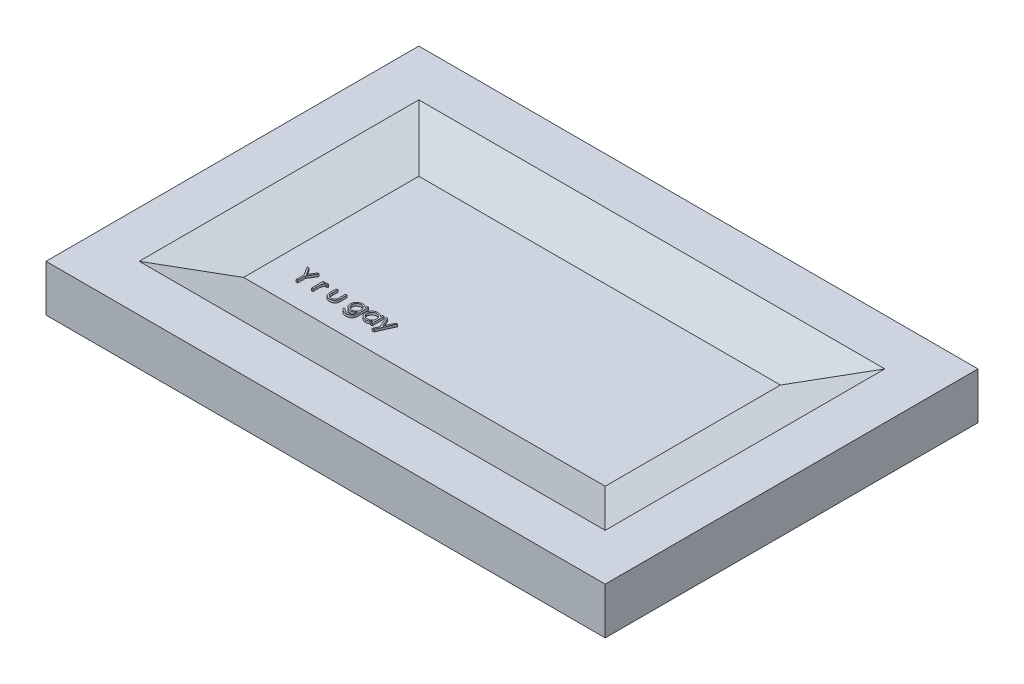
from build123d import *

# Parameters (mm, degrees)
SKETCH1_W           = 120
SKETCH1_H           = 80
BOSS_EXTRUDE1_DEPTH = 5
CUT_EXTRUDE1_DEPTH  = 3
CUT_EXTRUDE1_TAPER  = 75
SKETCH2_W           = 100
SKETCH2_H           = 60
CUT_EXTRUDE2_DEPTH  = 3
CUT_EXTRUDE2_DRAFT  = -75
BOSS_EXTRUDE2_DEPTH = 0.5


with BuildPart() as part:
    # Sketch1 → Boss-Extrude1 (new, symmetric)
    with BuildSketch(Plane(origin=(0, 0, 0), x_dir=(1, 0, 0), z_dir=(0, 1, 0))):
        Rectangle(SKETCH1_W, SKETCH1_H)
    extrude(amount=BOSS_EXTRUDE1_DEPTH, both=True)

    # 3DSketch1 → Cut-Extrude1 (cut)
    with BuildSketch(Plane(origin=(-50, 5, 30), x_dir=(0.8574929257125442, 0, -0.5144957554275267), z_dir=(0, -1, 0))):
        Polygon((0, 0), (30.869745326, -51.449575543), (116.619037897, 0), (85.749292571, 51.449575543), align=None)
    extrude(amount=CUT_EXTRUDE1_DEPTH, taper=CUT_EXTRUDE1_TAPER, mode=Mode.SUBTRACT)


with BuildPart() as cut_extrude2_tool:
    # Sketch2 → Cut-Extrude2 (with draft: the straight prism first)
    with BuildSketch(Plane.XZ.offset(5)):
        Rectangle(SKETCH2_W, SKETCH2_H)
    extrude(amount=-CUT_EXTRUDE2_DEPTH)
    # Cut-Extrude2: the draft: its side faces are tilted about the plane it starts from
    cut_extrude2_sides = [cut_extrude2_tool.faces().sort_by_distance(p)[0] for p in [
        (-50, -3.5, 0),
        (0, -3.5, -30),
        (50, -3.5, 0),
        (0, -3.5, 30),
    ]]
    draft(cut_extrude2_sides, Plane.XZ.offset(5), CUT_EXTRUDE2_DRAFT)


with BuildPart() as part_1:
    add(part.part)

    # Cut-Extrude2: cut by cut_extrude2_tool
    add(cut_extrude2_tool.part, mode=Mode.SUBTRACT)

    # Sketch3 → Boss-Extrude2 (add)
    # profile 1 of 6: a face of its own
    with BuildSketch(Plane(origin=(0, 2, 0), x_dir=(1, 0, 0), z_dir=(0, 1, 0))):
        Polygon((-33.400512967, -10.522417644), (-33.040837487, -10.522417644), (-32.120965692, -12.026323894), (-31.202496141, -10.522417644), (-30.84282066, -10.522417644), (-31.964615532, -12.358655625), (-31.964615532, -14.022417644), (-32.278718096, -14.022417644), (-32.278718096, -12.358655625), align=None)
    # profile 2 of 6: a face of its own
    with BuildSketch(Plane(origin=(0, 2, 0), x_dir=(1, 0, 0), z_dir=(0, 1, 0))):
        with BuildLine():
            Line((-29.047948865, -11.464725336), (-28.733846301, -11.464725336))
            Line((-28.733846301, -11.464725336), (-28.733846301, -11.84122774))
            add(Edge.make_bspline(
                [(-28.733846301, -11.84122774), (-28.710657542, -11.806171912), (-28.666309221, -11.739127912), (-28.592596292, -11.650458611), (-28.51709296, -11.577043565), (-28.439437773, -11.518540046), (-28.359059673, -11.474726927), (-28.277722722, -11.442633892), (-28.194147252, -11.423656577), (-28.137985327, -11.421122918), (-28.109847903, -11.419853541)],
                knots=[0, 0, 0, 0, 1.2804753, 2.448899062, 3.506932113, 4.484331642, 5.4025378, 6.288909075, 7.142734305, 8, 8, 8, 8], degree=3))
            add(Edge.make_bspline(
                [(-28.109847903, -11.419853541), (-28.088021577, -11.421044068), (-28.043112492, -11.423493654), (-27.975129902, -11.440704478), (-27.90508645, -11.468182501), (-27.859944063, -11.494022724), (-27.836410403, -11.507493766)],
                knots=[0, 0, 0, 0, 0.901110191, 1.854092781, 2.881294221, 4, 4, 4, 4], degree=3))
            Line((-27.836410403, -11.507493766), (-28.008886365, -11.779529022))
            add(Edge.make_bspline(
                [(-28.008886365, -11.779529022), (-28.023995386, -11.772788756), (-28.052675201, -11.75999444), (-28.094629767, -11.74485243), (-28.133311104, -11.735936514), (-28.157954662, -11.734585797), (-28.169443256, -11.733956105)],
                knots=[0, 0, 0, 0, 1.180555205, 2.24091978, 3.179933427, 4, 4, 4, 4], degree=3))
            add(Edge.make_bspline(
                [(-28.169443256, -11.733956105), (-28.194648989, -11.735636143), (-28.246061379, -11.739062932), (-28.321545879, -11.76600174), (-28.394793084, -11.80952698), (-28.452964747, -11.857798092), (-28.498007, -11.904345889), (-28.530147225, -11.944994292), (-28.559629972, -11.990572923), (-28.587800192, -12.040302607), (-28.613466487, -12.095032453), (-28.637421156, -12.154215666), (-28.659080019, -12.217920795), (-28.671430263, -12.262303315), (-28.677756557, -12.285037836)],
                knots=[0, 0, 0, 0, 1.125678352, 2.296057538, 3.5422874, 4.923748041, 5.663163013, 6.437101912, 7.23742474, 8.08941207, 8.991984279, 9.93940061, 10.944477711, 12, 12, 12, 12], degree=3))
            add(Edge.make_bspline(
                [(-28.677756557, -12.285037836), (-28.682488951, -12.30531501), (-28.692970842, -12.350227408), (-28.70316238, -12.425575933), (-28.713231898, -12.514599592), (-28.720328516, -12.617546185), (-28.726906559, -12.734158629), (-28.730616641, -12.864614574), (-28.733719781, -13.009047925), (-28.733802848, -13.110022279), (-28.733846301, -13.162842323)],
                knots=[0, 0, 0, 0, 0.566838948, 1.255505196, 2.06880316, 3.007127437, 4.065329342, 5.249902469, 6.561414163, 8, 8, 8, 8], degree=3))
            Line((-28.733846301, -13.162842323), (-28.733846301, -14.022417644))
            Line((-28.733846301, -14.022417644), (-29.047948865, -14.022417644))
            Line((-29.047948865, -14.022417644), (-29.047948865, -11.464725336))
        make_face()
    # profile 3 of 6: a face of its own
    with BuildSketch(Plane(origin=(0, 2, 0), x_dir=(1, 0, 0), z_dir=(0, 1, 0))):
        with BuildLine():
            Line((-26.221025788, -11.464725336), (-25.906923224, -11.464725336))
            Line((-25.906923224, -11.464725336), (-25.906923224, -12.651023413))
            add(Edge.make_bspline(
                [(-25.906923224, -12.651023413), (-25.906781319, -12.685846162), (-25.906509862, -12.75246045), (-25.904668921, -12.848315637), (-25.900338827, -12.93573235), (-25.894925002, -13.014761086), (-25.887962866, -13.085388478), (-25.879679506, -13.147367835), (-25.870421084, -13.201402019), (-25.86135837, -13.233945375), (-25.857143576, -13.249080304)],
                knots=[0, 0, 0, 0, 1.388932606, 2.656963016, 3.823490214, 4.879454478, 5.816252168, 6.653371382, 7.373723809, 8, 8, 8, 8], degree=3))
            add(Edge.make_bspline(
                [(-25.857143576, -13.249080304), (-25.850382121, -13.268103175), (-25.83699978, -13.305753436), (-25.812726297, -13.360142441), (-25.78269796, -13.410517724), (-25.749838132, -13.458821796), (-25.711938725, -13.503623783), (-25.669479253, -13.544848027), (-25.623881016, -13.584052118), (-25.556125993, -13.63043691), (-25.463466727, -13.68015224), (-25.341813972, -13.723048059), (-25.209909746, -13.748683879), (-25.118745027, -13.751658134), (-25.071887166, -13.753186875)],
                knots=[0, 0, 0, 0, 0.725840625, 1.436591201, 2.137033971, 2.831655856, 3.53531722, 4.242432219, 4.957935707, 5.694543706, 7.190802206, 8.724350549, 10.316345118, 12, 12, 12, 12], degree=3))
            add(Edge.make_bspline(
                [(-25.071887166, -13.753186875), (-25.025033658, -13.751625626), (-24.93438079, -13.748604899), (-24.803925821, -13.72382136), (-24.684674406, -13.682415671), (-24.577823455, -13.624608259), (-24.483857615, -13.553866197), (-24.405553196, -13.470857388), (-24.340945942, -13.378208001), (-24.312736521, -13.309083722), (-24.298549826, -13.274320689)],
                knots=[0, 0, 0, 0, 1.157059328, 2.238695713, 3.266970494, 4.264342957, 5.228770407, 6.160125903, 7.074715775, 8, 8, 8, 8], degree=3))
            add(Edge.make_bspline(
                [(-24.298549826, -13.274320689), (-24.294355596, -13.26035439), (-24.285083178, -13.229478315), (-24.275120827, -13.177098566), (-24.266146365, -13.114633962), (-24.258483189, -13.041675753), (-24.253018026, -12.958414601), (-24.250072, -12.864876524), (-24.246743724, -12.761355164), (-24.246693208, -12.688887405), (-24.246666814, -12.651023413)],
                knots=[0, 0, 0, 0, 0.557542046, 1.232589297, 2.036731608, 2.971723315, 4.038036528, 5.22795436, 6.551621927, 8, 8, 8, 8], degree=3))
            Line((-24.246666814, -12.651023413), (-24.246666814, -11.464725336))
            Line((-24.246666814, -11.464725336), (-23.93256425, -11.464725336))
            Line((-23.93256425, -11.464725336), (-23.93256425, -12.709917644))
            add(Edge.make_bspline(
                [(-23.93256425, -12.709917644), (-23.933005944, -12.752224815), (-23.933862893, -12.834306515), (-23.939370236, -12.953590627), (-23.948819849, -13.064752872), (-23.963162534, -13.167852091), (-23.980028208, -13.262809573), (-24.001784481, -13.349747019), (-24.027762719, -13.428396573), (-24.057068234, -13.50013835), (-24.091690102, -13.565185244), (-24.128517122, -13.626921061), (-24.171041894, -13.683813996), (-24.215812128, -13.738696133), (-24.265613784, -13.788837661), (-24.319513643, -13.835389136), (-24.376753063, -13.879062168), (-24.438602261, -13.918153448), (-24.504158324, -13.953370093), (-24.573502181, -13.984586171), (-24.647483179, -14.009288748), (-24.725146816, -14.030599414), (-24.806873595, -14.047313883), (-24.892584728, -14.05910045), (-24.982251345, -14.066325781), (-25.043360804, -14.066962825), (-25.074691653, -14.067289439)],
                knots=[0, 0, 0, 0, 1.493040784, 2.896703357, 4.213163133, 5.428574705, 6.569057535, 7.615249723, 8.588095153, 9.490268104, 10.346124644, 11.18633936, 12.024365274, 12.850166724, 13.684164916, 14.514361689, 15.362232829, 16.222528818, 17.093394965, 17.986930858, 18.902426812, 19.842810585, 20.827885679, 21.843828298, 22.894529745, 24, 24, 24, 24], degree=3))
            add(Edge.make_bspline(
                [(-25.074691653, -14.067289439), (-25.105788167, -14.066949732), (-25.166895713, -14.066282175), (-25.256566957, -14.059140368), (-25.342515563, -14.047332197), (-25.424435962, -14.03047698), (-25.502410359, -14.00943791), (-25.576754599, -13.984434374), (-25.646598162, -13.953353892), (-25.712780166, -13.918376335), (-25.774782554, -13.87881106), (-25.832891132, -13.83544302), (-25.887027985, -13.788336957), (-25.937205053, -13.7376896), (-25.982718029, -13.682872663), (-26.024134071, -13.624327103), (-26.062090776, -13.562633014), (-26.096443566, -13.496569852), (-26.125955322, -13.423997842), (-26.152010568, -13.343700745), (-26.173321206, -13.254798228), (-26.190663675, -13.1573663), (-26.204615115, -13.051871258), (-26.214301257, -12.937702843), (-26.219717088, -12.815139151), (-26.22058015, -12.730489261), (-26.221025788, -12.686780625)],
                knots=[0, 0, 0, 0, 1.083640291, 2.129454052, 3.13281866, 4.105697902, 5.042300162, 5.946461698, 6.836384745, 7.703652036, 8.553297018, 9.397182691, 10.228592656, 11.052265423, 11.879314572, 12.708807002, 13.549817954, 14.402308542, 15.300838682, 16.27712199, 17.341985831, 18.484375296, 19.725102775, 21.0496083, 22.476576903, 24, 24, 24, 24], degree=3))
            Line((-26.221025788, -12.686780625), (-26.221025788, -11.464725336))
        make_face()
    # profile 4 of 6: a face of its own
    with BuildSketch(Plane(origin=(0, 2, 0), x_dir=(1, 0, 0), z_dir=(0, 1, 0))):
        with BuildLine():
            Line((-19.624871942, -11.464725336), (-19.310769378, -11.464725336))
            Line((-19.310769378, -11.464725336), (-19.310769378, -13.494472932))
            add(Edge.make_bspline(
                [(-19.310769378, -13.494472932), (-19.31104642, -13.537710527), (-19.311581179, -13.6211695), (-19.31543215, -13.741847779), (-19.323552828, -13.853313865), (-19.332761509, -13.956076123), (-19.346008225, -14.049658233), (-19.362184593, -14.134339438), (-19.380420272, -14.210201), (-19.396440489, -14.256925841), (-19.404018576, -14.279028221)],
                knots=[0, 0, 0, 0, 1.307562039, 2.523909702, 3.650326591, 4.686913197, 5.643429486, 6.506965704, 7.293745905, 8, 8, 8, 8], degree=3))
            add(Edge.make_bspline(
                [(-19.404018576, -14.279028221), (-19.415207815, -14.307758142), (-19.437251742, -14.364358979), (-19.478537375, -14.4445933), (-19.524771279, -14.52013969), (-19.577578029, -14.590577141), (-19.636718833, -14.655552054), (-19.700800326, -14.716476053), (-19.771070517, -14.77206022), (-19.847489229, -14.821345518), (-19.928294862, -14.865732572), (-20.013440964, -14.904179139), (-20.102447403, -14.937665983), (-20.196150294, -14.962748778), (-20.293080529, -14.984483499), (-20.39437796, -14.998628185), (-20.499450757, -15.008255243), (-20.570896137, -15.009145476), (-20.607143576, -15.009597131)],
                knots=[0, 0, 0, 0, 0.981931301, 1.934503488, 2.87077864, 3.801706999, 4.735015492, 5.667491629, 6.616593066, 7.585388521, 8.561939025, 9.551802639, 10.560317337, 11.588439944, 12.640189604, 13.723962949, 14.845264515, 16, 16, 16, 16], degree=3))
            add(Edge.make_bspline(
                [(-20.607143576, -15.009597131), (-20.660028311, -15.008740645), (-20.763326406, -15.007067698), (-20.913931399, -14.987576783), (-21.056966119, -14.96002241), (-21.190540576, -14.918316982), (-21.313810672, -14.867279993), (-21.425934548, -14.80868504), (-21.525905656, -14.741495731), (-21.616029329, -14.66499513), (-21.697370919, -14.574031448), (-21.773898209, -14.466832604), (-21.84755915, -14.341765715), (-21.890727788, -14.249973002), (-21.91333348, -14.201904823)],
                knots=[0, 0, 0, 0, 1.157897085, 2.2616841, 3.32207898, 4.345638746, 5.321241055, 6.241986252, 7.112515963, 7.955008012, 8.825025602, 9.77857164, 10.836726669, 12, 12, 12, 12], degree=3))
            Line((-21.91333348, -14.201904823), (-21.599230916, -14.201904823))
            add(Edge.make_bspline(
                [(-21.599230916, -14.201904823), (-21.573968707, -14.242010699), (-21.524584198, -14.320412748), (-21.432235718, -14.421925903), (-21.331029391, -14.508679268), (-21.217549708, -14.578590042), (-21.091324493, -14.631299834), (-20.952277806, -14.66887513), (-20.799278185, -14.691371397), (-20.69275997, -14.694082691), (-20.637291814, -14.695494567)],
                knots=[0, 0, 0, 0, 0.997731894, 1.950442991, 2.880492273, 3.800895997, 4.748200782, 5.754801363, 6.83083817, 8, 8, 8, 8], degree=3))
            add(Edge.make_bspline(
                [(-20.637291814, -14.695494567), (-20.582524923, -14.694064418), (-20.476939841, -14.691307234), (-20.325108672, -14.66886509), (-20.186513734, -14.631291656), (-20.061953533, -14.57868327), (-19.952897764, -14.514232864), (-19.858885773, -14.442232789), (-19.782741097, -14.361051786), (-19.73152813, -14.28626998), (-19.699693513, -14.21964585), (-19.679421276, -14.162293254), (-19.662947306, -14.097440377), (-19.649167469, -14.025304641), (-19.637796556, -13.945782984), (-19.630593673, -13.85869358), (-19.625387862, -13.764234358), (-19.625047892, -13.69874122), (-19.624871942, -13.664845528)],
                knots=[0, 0, 0, 0, 1.570740765, 3.028230971, 4.391408896, 5.680370741, 6.894727393, 8.017376726, 9.065722033, 10.075533815, 10.603371122, 11.180248986, 11.817768598, 12.521299649, 13.286540596, 14.121245857, 15.027658897, 16, 16, 16, 16], degree=3))
            Line((-19.624871942, -13.664845528), (-19.624871942, -13.532333509))
            add(Edge.make_bspline(
                [(-19.624871942, -13.532333509), (-19.656753059, -13.570275311), (-19.719954515, -13.645491531), (-19.829101842, -13.744053168), (-19.948318758, -13.828939298), (-20.0774023, -13.898557932), (-20.213190542, -13.954239357), (-20.354212773, -13.993182318), (-20.499204828, -14.018342218), (-20.597456978, -14.021049534), (-20.647107519, -14.022417644)],
                knots=[0, 0, 0, 0, 1.012485704, 2.007162095, 2.997754123, 3.998611389, 4.999708251, 5.992315798, 6.98544096, 8, 8, 8, 8], degree=3))
            add(Edge.make_bspline(
                [(-20.647107519, -14.022417644), (-20.676343788, -14.021902617), (-20.734470346, -14.020878659), (-20.820825093, -14.011919882), (-20.905905531, -13.998921139), (-20.989513235, -13.9798397), (-21.071768848, -13.955347974), (-21.15253644, -13.924731235), (-21.232469967, -13.890116117), (-21.310116465, -13.849343313), (-21.384702595, -13.803981007), (-21.45566578, -13.754842116), (-21.52263432, -13.702183828), (-21.584970809, -13.645486888), (-21.64259348, -13.584833355), (-21.696277348, -13.520869802), (-21.745134696, -13.452703061), (-21.790168085, -13.381576103), (-21.829225635, -13.307015179), (-21.863510007, -13.230637084), (-21.893319412, -13.152605129), (-21.917084814, -13.072658067), (-21.935235927, -12.990846298), (-21.948746154, -12.907303849), (-21.956409086, -12.821773461), (-21.95760401, -12.764152112), (-21.958205275, -12.735158028)],
                knots=[0, 0, 0, 0, 1.028754217, 2.045334182, 3.052854819, 4.056607503, 5.061168794, 6.071104265, 7.095078842, 8.125279047, 9.155117945, 10.165957491, 11.161587969, 12.151493252, 13.128948131, 14.104219989, 15.088194871, 16.07871515, 17.064853787, 18.047899887, 19.02414258, 20.002704429, 20.980574569, 21.971845993, 22.979467364, 24, 24, 24, 24], degree=3))
            add(Edge.make_bspline(
                [(-21.958205275, -12.735158028), (-21.957686109, -12.706154932), (-21.956649787, -12.648261074), (-21.947698808, -12.562381688), (-21.934930618, -12.477652253), (-21.914722849, -12.394946111), (-21.890400327, -12.31332136), (-21.860276754, -12.233380903), (-21.824057995, -12.155100394), (-21.783048245, -12.078421863), (-21.736964153, -12.004374248), (-21.686431672, -11.934047602), (-21.631389798, -11.86795943), (-21.572597882, -11.805443008), (-21.509338065, -11.747101515), (-21.441643073, -11.69307655), (-21.370180192, -11.642462524), (-21.294727942, -11.596351186), (-21.216450554, -11.55556894), (-21.137336736, -11.518356343), (-21.056338501, -11.488822223), (-20.974965962, -11.462799124), (-20.891786047, -11.444363929), (-20.807818653, -11.430141687), (-20.722776315, -11.421476966), (-20.66582342, -11.420395381), (-20.637291814, -11.419853541)],
                knots=[0, 0, 0, 0, 1.008818848, 2.013730394, 3.001654427, 3.987803273, 4.973046549, 5.963777569, 6.957074694, 7.972068341, 8.987420212, 9.989399531, 10.982630087, 11.977756091, 12.973280677, 13.973972381, 14.989194003, 16.018387222, 17.047741039, 18.059210846, 19.057554164, 20.045176975, 21.029480261, 22.018708529, 23.007435371, 24, 24, 24, 24], degree=3))
            add(Edge.make_bspline(
                [(-20.637291814, -11.419853541), (-20.590240875, -11.421210215), (-20.497329727, -11.423889227), (-20.360598725, -11.444910373), (-20.228656485, -11.478424386), (-20.100758469, -11.526440017), (-19.975862818, -11.591990055), (-19.854381163, -11.678333003), (-19.735962029, -11.786243343), (-19.662884198, -11.868996207), (-19.624871942, -11.912041041)],
                knots=[0, 0, 0, 0, 0.96728863, 1.910097829, 2.838038873, 3.762875196, 4.71315279, 5.730631239, 6.819562287, 8, 8, 8, 8], degree=3))
            Line((-19.624871942, -11.912041041), (-19.624871942, -11.464725336))
        make_face()
        with BuildLine():
            add(Edge.make_bspline(
                [(-20.612051429, -11.733956105), (-20.657982133, -11.735517171), (-20.748915187, -11.73860775), (-20.88220353, -11.764992463), (-21.010880463, -11.806338363), (-21.132485891, -11.865480978), (-21.246393001, -11.937575216), (-21.347467822, -12.024915504), (-21.435872738, -12.124661701), (-21.510655676, -12.235911948), (-21.570187043, -12.355934223), (-21.612330462, -12.482444957), (-21.639580485, -12.61339995), (-21.642588137, -12.702772553), (-21.644102711, -12.747778221)],
                knots=[0, 0, 0, 0, 1.026226791, 2.031711442, 3.026614839, 4.04107745, 5.047145931, 6.032893242, 7.017642609, 8.019221815, 9.021877557, 10.003543541, 10.994637589, 12, 12, 12, 12], degree=3))
            add(Edge.make_bspline(
                [(-21.644102711, -12.747778221), (-21.643376954, -12.781711493), (-21.641949603, -12.848448317), (-21.628226025, -12.946386212), (-21.60604506, -13.039666526), (-21.574607854, -13.1282949), (-21.535655159, -13.212779695), (-21.486662788, -13.29253893), (-21.429011816, -13.367643636), (-21.363153478, -13.437538318), (-21.290577096, -13.501199286), (-21.211857897, -13.557137327), (-21.127102647, -13.602888048), (-21.038395837, -13.642428885), (-20.943585081, -13.671307953), (-20.844035995, -13.693346732), (-20.739044298, -13.70595549), (-20.667472559, -13.707518287), (-20.630981717, -13.70831508)],
                knots=[0, 0, 0, 0, 1.039728707, 2.044842319, 3.024901384, 3.974314358, 4.923051295, 5.871625912, 6.837440708, 7.820715446, 8.810779094, 9.792721783, 10.773906224, 11.758876063, 12.764959493, 13.806266761, 14.881525401, 16, 16, 16, 16], degree=3))
            add(Edge.make_bspline(
                [(-20.630981717, -13.70831508), (-20.594017959, -13.707547471), (-20.521735722, -13.706046419), (-20.416164785, -13.693142921), (-20.316132045, -13.672320944), (-20.221729223, -13.642757919), (-20.132599882, -13.605036169), (-20.049745267, -13.557299551), (-19.971388819, -13.502935119), (-19.900032409, -13.439523105), (-19.835508244, -13.36963811), (-19.779277477, -13.293593215), (-19.731363028, -13.212532696), (-19.691685358, -13.12646569), (-19.661394154, -13.034723337), (-19.641075249, -12.937534981), (-19.626868504, -12.835366242), (-19.625547579, -12.765357626), (-19.624871942, -12.729549054)],
                knots=[0, 0, 0, 0, 1.121943988, 2.193949579, 3.223793937, 4.220241907, 5.192961521, 6.155822191, 7.11847367, 8.083710714, 9.04790392, 10.001595906, 10.949595423, 11.902125208, 12.873731292, 13.87582262, 14.913508608, 16, 16, 16, 16], degree=3))
            add(Edge.make_bspline(
                [(-19.624871942, -12.729549054), (-19.62621151, -12.6829312), (-19.628828555, -12.591856295), (-19.653525713, -12.459149527), (-19.693345923, -12.334380853), (-19.749192676, -12.217944877), (-19.819174684, -12.111075328), (-19.903465533, -12.015751483), (-20.000611564, -11.931850627), (-20.110333664, -11.861952433), (-20.228381109, -11.805486999), (-20.351902305, -11.763125227), (-20.480713869, -11.739130912), (-20.568020279, -11.735690968), (-20.612051429, -11.733956105)],
                knots=[0, 0, 0, 0, 1.070913519, 2.092188694, 3.091357305, 4.074328408, 5.051968682, 6.018948707, 6.99050112, 7.9935919, 9.000589572, 9.992915277, 10.987769056, 12, 12, 12, 12], degree=3))
        make_face(mode=Mode.SUBTRACT)
    # profile 5 of 6: a face of its own
    with BuildSketch(Plane(origin=(0, 2, 0), x_dir=(1, 0, 0), z_dir=(0, 1, 0))):
        with BuildLine():
            Line((-15.990256557, -11.464725336), (-15.990256557, -14.022417644))
            Line((-15.990256557, -14.022417644), (-16.304359121, -14.022417644))
            Line((-16.304359121, -14.022417644), (-16.304359121, -13.580009791))
            add(Edge.make_bspline(
                [(-16.304359121, -13.580009791), (-16.339777912, -13.620049385), (-16.408898127, -13.698187156), (-16.524339245, -13.800269329), (-16.646707423, -13.88464765), (-16.775408744, -13.952797566), (-16.910326988, -14.003989622), (-17.051163075, -14.040375781), (-17.197974456, -14.063769617), (-17.298226811, -14.066105639), (-17.349030596, -14.067289439)],
                knots=[0, 0, 0, 0, 1.074387032, 2.096679803, 3.090159297, 4.057316773, 5.018401886, 5.985159533, 6.978961417, 8, 8, 8, 8], degree=3))
            add(Edge.make_bspline(
                [(-17.349030596, -14.067289439), (-17.39419855, -14.066063066), (-17.483271754, -14.063644606), (-17.614300832, -14.044882302), (-17.740393081, -14.014751681), (-17.861667654, -13.972850791), (-17.977339799, -13.91726997), (-18.088399896, -13.850728722), (-18.194272588, -13.771487891), (-18.293344127, -13.680899863), (-18.384576127, -13.582504876), (-18.4646374, -13.477559329), (-18.53139048, -13.366517025), (-18.58721056, -13.250783871), (-18.630206905, -13.129468952), (-18.660180539, -13.002991784), (-18.678920986, -12.87150191), (-18.681338446, -12.781962387), (-18.68256425, -12.736560272)],
                knots=[0, 0, 0, 0, 1.033919861, 2.038935746, 3.024066025, 3.998881131, 4.97069526, 5.957263378, 6.95902576, 7.993208707, 9.027059324, 10.027763471, 11.009749337, 11.988697705, 12.965288445, 13.950418724, 14.960734635, 16, 16, 16, 16], degree=3))
            add(Edge.make_bspline(
                [(-18.68256425, -12.736560272), (-18.681311278, -12.692096568), (-18.678834221, -12.604194225), (-18.660381001, -12.474915527), (-18.629349993, -12.350397266), (-18.585802145, -12.231040323), (-18.52996019, -12.116700273), (-18.462032103, -12.007296248), (-18.382012978, -11.902526851), (-18.289760571, -11.804855624), (-18.189825801, -11.714635009), (-18.08291707, -11.636225964), (-17.971693789, -11.568509115), (-17.854430779, -11.514855639), (-17.732863674, -11.471446534), (-17.605910228, -11.441413566), (-17.474098649, -11.423716245), (-17.384608157, -11.421153481), (-17.339214891, -11.419853541)],
                knots=[0, 0, 0, 0, 1.020392517, 2.01726096, 2.990465484, 3.961182959, 4.928053699, 5.906110375, 6.912531644, 7.948652711, 8.985773172, 9.998621852, 10.987621588, 11.969261332, 12.953316658, 13.946091881, 14.958173133, 16, 16, 16, 16], degree=3))
            add(Edge.make_bspline(
                [(-17.339214891, -11.419853541), (-17.287015031, -11.421291293), (-17.184653572, -11.424110656), (-17.034925562, -11.447573383), (-16.893281084, -11.48721185), (-16.758626732, -11.541129348), (-16.631446046, -11.612778077), (-16.512943062, -11.703158038), (-16.401877579, -11.811699225), (-16.337497287, -11.89506967), (-16.304359121, -11.937982548)],
                knots=[0, 0, 0, 0, 1.038897134, 2.037228247, 3.008116434, 3.962042015, 4.918381754, 5.904844433, 6.921570401, 8, 8, 8, 8], degree=3))
            Line((-16.304359121, -11.937982548), (-16.304359121, -11.464725336))
            Line((-16.304359121, -11.464725336), (-15.990256557, -11.464725336))
        make_face()
        with BuildLine():
            add(Edge.make_bspline(
                [(-17.33500816, -11.733956105), (-17.380922498, -11.735589743), (-17.471550098, -11.738814284), (-17.6045941, -11.763987779), (-17.731907514, -11.805872374), (-17.852853588, -11.863154275), (-17.965521805, -11.935183011), (-18.066215476, -12.022304395), (-18.155758177, -12.122141409), (-18.231066441, -12.234243519), (-18.292456938, -12.35442161), (-18.33562397, -12.480046048), (-18.364093217, -12.608851026), (-18.367001738, -12.696213712), (-18.368461685, -12.740065881)],
                knots=[0, 0, 0, 0, 1.031046209, 2.035121221, 3.029706178, 4.034933723, 5.034054252, 6.02443088, 7.017295772, 8.038157696, 9.050218397, 10.03989886, 11.016116709, 12, 12, 12, 12], degree=3))
            add(Edge.make_bspline(
                [(-18.368461685, -12.740065881), (-18.366596792, -12.783655988), (-18.362874315, -12.870665344), (-18.336123621, -12.999645921), (-18.291243747, -13.125299963), (-18.230001685, -13.246560956), (-18.15331506, -13.359145057), (-18.064426407, -13.460885179), (-17.962476126, -13.548374768), (-17.849548619, -13.621612341), (-17.728940649, -13.680774862), (-17.602106717, -13.721940502), (-17.471431079, -13.748518282), (-17.382578745, -13.751622759), (-17.337812647, -13.753186875)],
                knots=[0, 0, 0, 0, 0.979072187, 1.954306742, 2.945804271, 3.96968567, 4.997920485, 5.998718438, 6.996577872, 8.005894225, 9.015743152, 10.005417472, 10.995077863, 12, 12, 12, 12], degree=3))
            add(Edge.make_bspline(
                [(-17.337812647, -13.753186875), (-17.292366144, -13.751526911), (-17.201977558, -13.748225407), (-17.06853885, -13.722944142), (-16.939043887, -13.681175343), (-16.815256659, -13.623276217), (-16.699940527, -13.551518861), (-16.59644265, -13.46751177), (-16.508926681, -13.369808586), (-16.434734072, -13.262432133), (-16.376558655, -13.144720136), (-16.334182596, -13.019385945), (-16.30912869, -12.886425197), (-16.305970961, -12.79556127), (-16.304359121, -12.749180464)],
                knots=[0, 0, 0, 0, 1.01762866, 2.023962475, 3.030623092, 4.058876274, 5.077231937, 6.066672613, 7.034107872, 8.005628644, 8.981990164, 9.965428785, 10.961468474, 12, 12, 12, 12], degree=3))
            add(Edge.make_bspline(
                [(-16.304359121, -12.749180464), (-16.305318778, -12.713842634), (-16.307207685, -12.6442866), (-16.321638255, -12.542159083), (-16.344593181, -12.444425357), (-16.376939351, -12.350982668), (-16.419430636, -12.262347652), (-16.470678401, -12.177883892), (-16.531583851, -12.098030681), (-16.601166547, -12.02388761), (-16.67733175, -11.956261148), (-16.75792629, -11.895896907), (-16.843905037, -11.846308134), (-16.933822074, -11.805266863), (-17.027833409, -11.772607713), (-17.126704029, -11.750820019), (-17.229383015, -11.735859698), (-17.299429071, -11.734597317), (-17.33500816, -11.733956105)],
                knots=[0, 0, 0, 0, 1.050140795, 2.067009409, 3.05949893, 4.030605086, 5.00011959, 5.97591094, 6.962425594, 7.979863591, 8.993523472, 9.986985069, 10.967611495, 11.937549037, 12.921786183, 13.919465291, 14.943216303, 16, 16, 16, 16], degree=3))
        make_face(mode=Mode.SUBTRACT)
    # profile 6 of 6: a face of its own
    with BuildSketch(Plane(origin=(0, 2, 0), x_dir=(1, 0, 0), z_dir=(0, 1, 0))):
        Polygon((-15.541538609, -11.464725336), (-15.202896782, -11.464725336), (-14.337011365, -13.423659631), (-13.457804634, -11.464725336), (-13.118461685, -11.464725336), (-14.688974506, -14.964725336), (-15.028317455, -14.964725336), (-14.507383961, -13.804368766), align=None)
    extrude(amount=BOSS_EXTRUDE2_DEPTH)


solid = part_1.part
